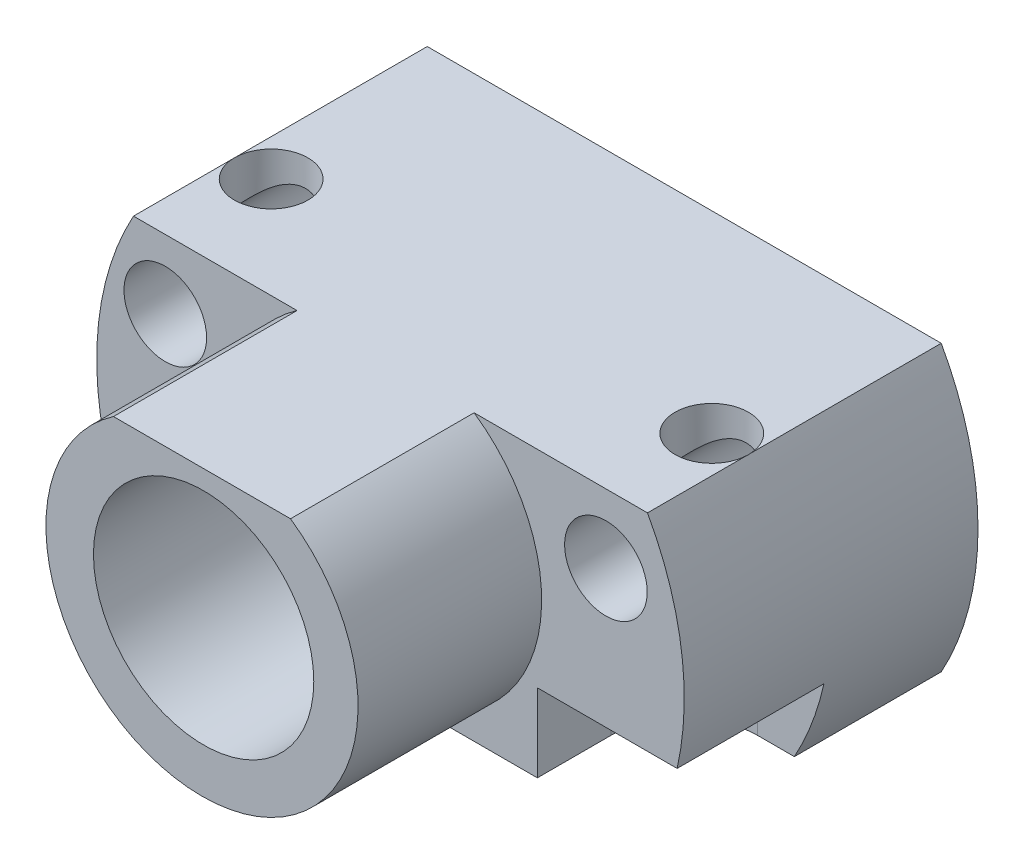
from build123d import *

# Parameters (mm, degrees)
BOSS_EXTRU_1_DEPTH      = 32
ESQUISSE2_R             = 4
ENL_V_MAT_EXTRU_1_DEPTH = 32
ESQUISSE3_R             = 4.5
ENL_V_MAT_EXTRU_3_DEPTH = 42
ENL_V_MAT_EXTRU_4_DEPTH = 8.5
BOSS_EXTRU_2_DEPTH      = 20
ESQUISSE7_R             = 12
ENL_V_MAT_EXTRU_5_DEPTH = 33


with BuildPart() as part:
    # Esquisse1 → Boss.-Extru.1 (new body)
    with BuildSketch(Plane.XY):
        with BuildLine():
            Line((-27.461265237, 12.171141476), (28.529805479, 12.171141476))
            ThreePointArc((28.529805479, 12.171141476), (32.534270121, -3.328858524), (28.529805479, -18.828858524))
            Line((28.529805479, -18.828858524), (-27.461265237, -18.828858524))
            ThreePointArc((-27.461265237, -18.828858524), (-31.465729879, -3.328858524), (-27.461265237, 12.171141476))
        make_face()
    extrude(amount=BOSS_EXTRU_1_DEPTH)

    # Esquisse2 → Enlèv. mat.-Extru.1 (cut)
    with BuildSketch(Plane.XZ.offset(18.828858524)):
        with Locations(Location((24.534270121, 21, 0), (0, 0, 357.292669089))):
            Circle(ESQUISSE2_R)
        with Locations(Location((-23.465729879, 21, 0), (0, 0, 182.707330911))):
            Circle(ESQUISSE2_R)
    extrude(amount=-ENL_V_MAT_EXTRU_1_DEPTH, mode=Mode.SUBTRACT)

    # Esquisse3 → Enlèv. mat.-Extru.3 (cut)
    with BuildSketch(Plane.XY):
        with Locations((-24, 4.671141476)):
            Circle(ESQUISSE3_R)
        with Locations(Location((24, 4.671141476, 0), (0, 0, 180))):
            Circle(ESQUISSE3_R)
    extrude(amount=ENL_V_MAT_EXTRU_3_DEPTH, mode=Mode.SUBTRACT)

    # Esquisse5 → Enlèv. mat.-Extru.4 (cut)
    with BuildSketch(Plane.XZ.offset(18.828858524)):
        with BuildLine():
            Line((-15.465729879, 32), (-15.465729879, 24))
            ThreePointArc((-15.465729879, 24), (-17.80887563, 18.343145751), (-23.465729879, 16))
            Line((-23.465729879, 16), (-31.465729879, 16))
            Line((-31.465729879, 16), (-31.465729879, 32))
            Line((-31.465729879, 32), (-15.465729879, 32))
        make_face()
        with BuildLine():
            Line((24.534270121, 16), (32.534270121, 16))
            Line((32.534270121, 16), (32.534270121, 32))
            Line((32.534270121, 32), (16.534270121, 32))
            Line((16.534270121, 32), (16.534270121, 24))
            ThreePointArc((16.534270121, 24), (18.877415871, 18.343145751), (24.534270121, 16))
        make_face()
    extrude(amount=-ENL_V_MAT_EXTRU_4_DEPTH, mode=Mode.SUBTRACT)

    # Esquisse6 → Boss.-Extru.2 (add)
    with BuildSketch(Plane.XY.offset(32)):
        with BuildLine():
            Line((9.643650761, 12.171141476), (-9.643650761, 12.171141476))
            ThreePointArc((-9.643650761, 12.171141476), (-7.907526069, -16.877813022), (17, -1.828858524))
            ThreePointArc((17, -1.828858524), (15.048954498, 6.078667545), (9.643650761, 12.171141476))
        make_face()
    extrude(amount=BOSS_EXTRU_2_DEPTH)

    # Esquisse7 → Enlèv. mat.-Extru.5 (cut)
    with BuildSketch(Plane.XY.offset(52)):
        with Locations((0.177122326, -1.910835069)):
            Circle(ESQUISSE7_R)
    extrude(amount=-ENL_V_MAT_EXTRU_5_DEPTH, mode=Mode.SUBTRACT)


solid = part.part
